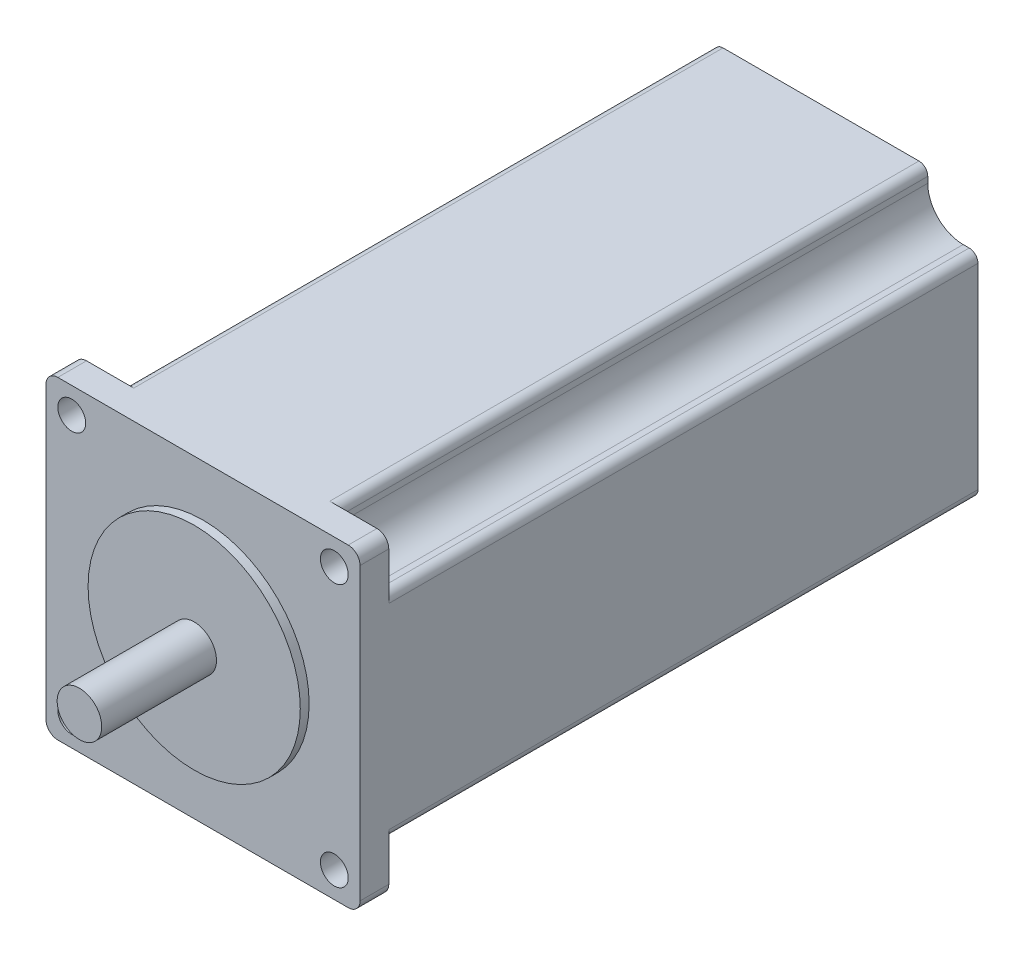
from build123d import *

# Parameters (mm, degrees)
SKETCH1_R           = 2.5019
BOSS_EXTRUDE1_DEPTH = 110.9472
SKETCH2_R           = 19.05
BOSS_EXTRUDE2_DEPTH = 1.5875
SKETCH3_R           = 4.0005
BOSS_EXTRUDE3_DEPTH = 20.5994
CUT_EXTRUDE1_DEPTH  = 105.791


with BuildPart() as part:
    # Sketch1 → Boss-Extrude1 (new body)
    with BuildSketch(Plane.XY):
        with BuildLine():
            Line((-34.002396427, 28.194), (18.143803573, 28.194))
            ThreePointArc((18.143803573, 28.194), (19.643506345, 27.572802772), (20.264703573, 26.0731))
            Line((20.264703573, 26.0731), (20.264703573, -26.0731))
            ThreePointArc((20.264703573, -26.0731), (19.643506345, -27.572802772), (18.143803573, -28.194))
            Line((18.143803573, -28.194), (-34.002396427, -28.194))
            ThreePointArc((-34.002396427, -28.194), (-35.502099199, -27.572802772), (-36.123296427, -26.0731))
            Line((-36.123296427, -26.0731), (-36.123296427, 26.0731))
            ThreePointArc((-36.123296427, 26.0731), (-35.502099199, 27.572802772), (-34.002396427, 28.194))
        make_face()
        with Locations((15.641903573, 23.5712)):
            Circle(SKETCH1_R, mode=Mode.SUBTRACT)
        with Locations(Location((-31.500496427, 23.5712, 0), (0, 0, 180))):
            Circle(SKETCH1_R, mode=Mode.SUBTRACT)
        with Locations((-31.500496427, -23.5712)):
            Circle(SKETCH1_R, mode=Mode.SUBTRACT)
        with Locations(Location((15.641903573, -23.5712, 0), (0, 0, 180))):
            Circle(SKETCH1_R, mode=Mode.SUBTRACT)
    extrude(amount=BOSS_EXTRUDE1_DEPTH)

    # Sketch2 → Boss-Extrude2 (add)
    with BuildSketch(Plane.XY.offset(110.9472)):
        with Locations((-7.929296427, 0)):
            Circle(SKETCH2_R)
    extrude(amount=BOSS_EXTRUDE2_DEPTH)

    # Sketch3 → Boss-Extrude3 (add)
    with BuildSketch(Plane.XY.offset(112.5347)):
        with Locations((-7.929296427, 0)):
            Circle(SKETCH3_R)
    extrude(amount=BOSS_EXTRUDE3_DEPTH)

    # Sketch4 → Cut-Extrude1 (cut)
    with BuildSketch(Plane(origin=(0, 0, 0), x_dir=(-1, 0, 0), z_dir=(0, 0, -1))):
        with BuildLine():
            Line((34.535796427, -19.177), (33.456296427, -19.177))
            ThreePointArc((33.456296427, -19.177), (28.966168367, -21.036871939), (27.106296427, -25.527))
            Line((27.106296427, -25.527), (27.106296427, -26.6065))
            ThreePointArc((27.106296427, -26.6065), (26.641328442, -27.729032015), (25.518796427, -28.194))
            Line((25.518796427, -28.194), (18.677208221, -28.194))
            Line((18.677208221, -28.194), (18.677208221, -39.079996732))
            Line((18.677208221, -39.079996732), (53.323924266, -39.079996732))
            Line((53.323924266, -39.079996732), (53.323924266, -7.667262783))
            Line((53.323924266, -7.667262783), (36.123296427, -7.667262783))
            Line((36.123296427, -7.667262783), (36.123296427, -17.5895))
            ThreePointArc((36.123296427, -17.5895), (35.658328442, -18.712032015), (34.535796427, -19.177))
        make_face()
        with BuildLine():
            Line((36.123296427, 7.667262783), (36.123296427, 17.5895))
            ThreePointArc((36.123296427, 17.5895), (35.658328442, 18.712032015), (34.535796427, 19.177))
            Line((34.535796427, 19.177), (33.456296427, 19.177))
            ThreePointArc((33.456296427, 19.177), (28.966168367, 21.036871939), (27.106296427, 25.527))
            Line((27.106296427, 25.527), (27.106296427, 26.6065))
            ThreePointArc((27.106296427, 26.6065), (26.641328442, 27.729032015), (25.518796427, 28.194))
            Line((25.518796427, 28.194), (18.677208221, 28.194))
            Line((18.677208221, 28.194), (18.677208221, 39.079996732))
            Line((18.677208221, 39.079996732), (53.323924266, 39.079996732))
            Line((53.323924266, 39.079996732), (53.323924266, 7.667262783))
            Line((53.323924266, 7.667262783), (36.123296427, 7.667262783))
        make_face()
        with BuildLine():
            Line((-18.677203573, 19.177), (-17.597703573, 19.177))
            ThreePointArc((-17.597703573, 19.177), (-13.107575512, 21.036871939), (-11.247703573, 25.527))
            Line((-11.247703573, 25.527), (-11.247703573, 26.6065))
            ThreePointArc((-11.247703573, 26.6065), (-10.782735588, 27.729032015), (-9.660203573, 28.194))
            Line((-9.660203573, 28.194), (-2.818615366, 28.194))
            Line((-2.818615366, 28.194), (-2.818615366, 39.079996732))
            Line((-2.818615366, 39.079996732), (-37.465331412, 39.079996732))
            Line((-37.465331412, 39.079996732), (-37.465331412, 7.667262783))
            Line((-37.465331412, 7.667262783), (-20.264703573, 7.667262783))
            Line((-20.264703573, 7.667262783), (-20.264703573, 17.5895))
            ThreePointArc((-20.264703573, 17.5895), (-19.799735588, 18.712032015), (-18.677203573, 19.177))
        make_face()
        with BuildLine():
            Line((-20.264703573, -7.667262783), (-20.264703573, -17.5895))
            ThreePointArc((-20.264703573, -17.5895), (-19.799735588, -18.712032015), (-18.677203573, -19.177))
            Line((-18.677203573, -19.177), (-17.597703573, -19.177))
            ThreePointArc((-17.597703573, -19.177), (-13.107575512, -21.036871939), (-11.247703573, -25.527))
            Line((-11.247703573, -25.527), (-11.247703573, -26.6065))
            ThreePointArc((-11.247703573, -26.6065), (-10.782735588, -27.729032015), (-9.660203573, -28.194))
            Line((-9.660203573, -28.194), (-2.818615366, -28.194))
            Line((-2.818615366, -28.194), (-2.818615366, -39.079996732))
            Line((-2.818615366, -39.079996732), (-37.465331412, -39.079996732))
            Line((-37.465331412, -39.079996732), (-37.465331412, -7.667262783))
            Line((-37.465331412, -7.667262783), (-20.264703573, -7.667262783))
        make_face()
    extrude(amount=-CUT_EXTRUDE1_DEPTH, mode=Mode.SUBTRACT)


solid = part.part
